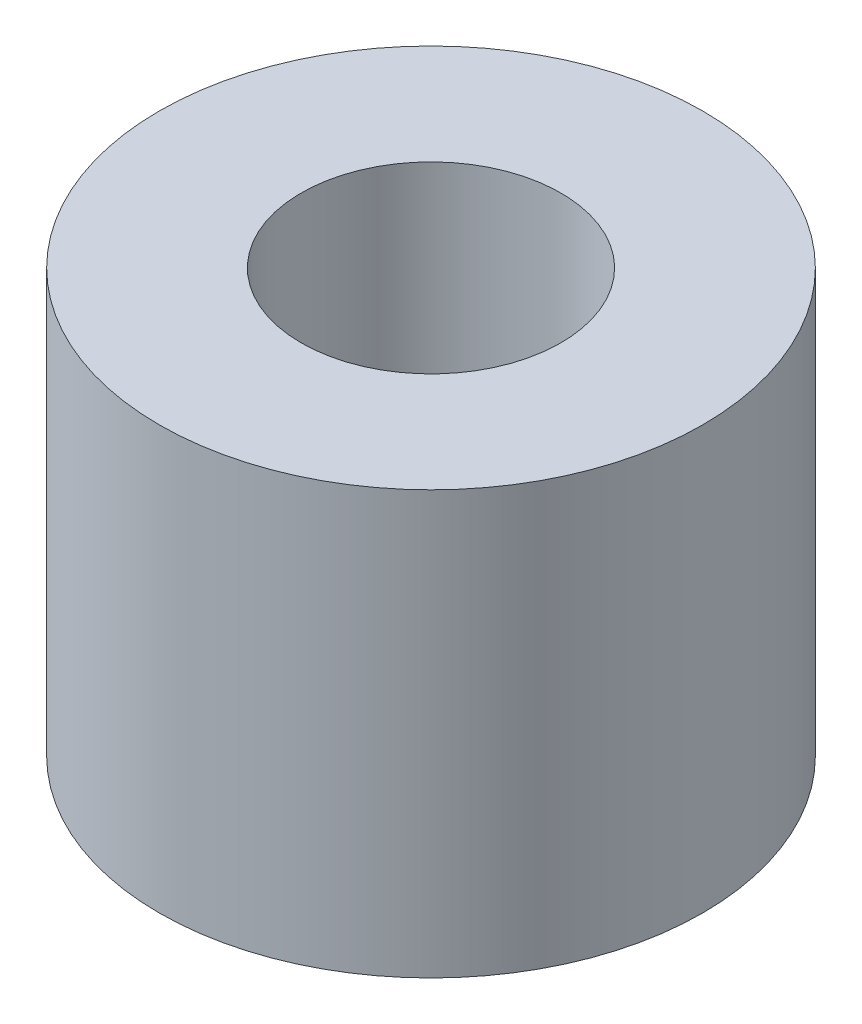
from build123d import *

# Parameters (mm, degrees)
SKETCH_1_R      = 4.5
SKETCH_1_R_2    = 2.15
EXTRUDE_1_DEPTH = 7


with BuildPart() as part:
    # Эскиз1 → Бобышка-Вытянуть1 (new body)
    with BuildSketch(Plane(origin=(0, 0, 0), x_dir=(1, 0, 0), z_dir=(0, 1, 0))):
        with Locations(Location((0, 0, 0), (0, 0, 270))):
            Circle(SKETCH_1_R)
        with Locations(Location((0, 0, 0), (0, 0, 270))):
            Circle(SKETCH_1_R_2, mode=Mode.SUBTRACT)
    extrude(amount=EXTRUDE_1_DEPTH)


solid = part.part
